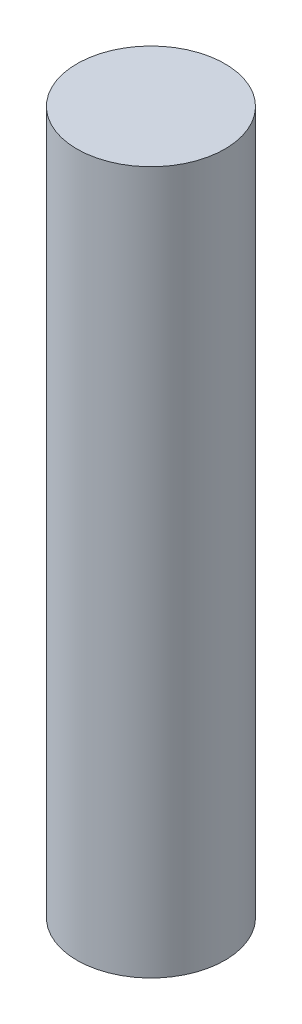
from build123d import *

# Parameters (mm, degrees)
SKETCH1_R           = 4
BOSS_EXTRUDE1_DEPTH = 38


with BuildPart() as part:
    # Sketch1 → Boss-Extrude1 (new body)
    with BuildSketch(Plane(origin=(0, 0, 0), x_dir=(1, 0, 0), z_dir=(0, 1, 0))):
        with Locations(Location((0, 0, 0), (0, 0, 270))):
            Circle(SKETCH1_R)
    extrude(amount=BOSS_EXTRUDE1_DEPTH)


solid = part.part
